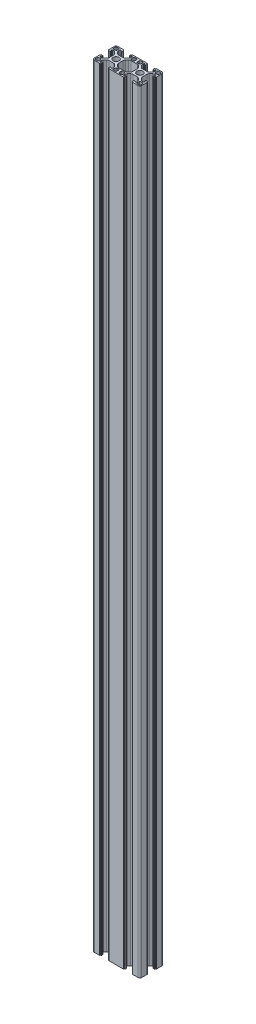
from build123d import *

# Parameters (mm, degrees)
EXTRUDE_1_DEPTH = 650


with BuildPart() as part:
    # Эскиз1 → Бобышка-Вытянуть1 (new body)
    with BuildSketch(Plane(origin=(0, 0, 0), x_dir=(1, 0, 0), z_dir=(0, 1, 0))):
        with BuildLine():
            Line((9.247825015, 4.683728486), (11.146605684, 4.683728486))
            ThreePointArc((11.146605684, 4.683728486), (11.911972549, 4.835969421), (12.560819246, 5.269514923))
            Line((12.560819246, 5.269514923), (13.862038577, 6.570734254))
            ThreePointArc((13.862038577, 6.570734254), (14.29558408, 7.219580952), (14.447825015, 7.984947817))
            Line((14.447825015, 7.984947817), (14.447825015, 8.883728486))
            ThreePointArc((14.447825015, 8.883728486), (14.301378405, 9.237281876), (13.947825015, 9.383728486))
            Line((13.947825015, 9.383728486), (13.844931796, 9.383728486))
            ThreePointArc((13.844931796, 9.383728486), (13.65359008, 9.345668252), (13.491378405, 9.237281876))
            Line((13.491378405, 9.237281876), (13.01104832, 8.75695179))
            ThreePointArc((13.01104832, 8.75695179), (12.929942482, 8.702758603), (12.834271624, 8.683728486))
            Line((12.834271624, 8.683728486), (12.547825015, 8.683728486))
            ThreePointArc((12.547825015, 8.683728486), (12.37104832, 8.75695179), (12.297825015, 8.933728486))
            Line((12.297825015, 8.933728486), (12.297825015, 10.082799306))
            ThreePointArc((12.297825015, 10.082799306), (12.341758998, 10.188865323), (12.447825015, 10.232799306))
            Line((12.447825015, 10.232799306), (12.947825015, 10.232799306))
            Line((12.947825015, 10.232799306), (12.947825015, 10.533728486))
            ThreePointArc((12.947825015, 10.533728486), (12.991758998, 10.639794503), (13.097825015, 10.683728486))
            Line((13.097825015, 10.683728486), (17.747825015, 10.683728486))
            ThreePointArc((17.747825015, 10.683728486), (18.808485187, 10.244388658), (19.247825015, 9.183728486))
            Line((19.247825015, 9.183728486), (19.247825015, 4.533728486))
            ThreePointArc((19.247825015, 4.533728486), (19.203891032, 4.427662469), (19.097825015, 4.383728486))
            Line((19.097825015, 4.383728486), (18.796895835, 4.383728486))
            Line((18.796895835, 4.383728486), (18.796895835, 3.883728486))
            ThreePointArc((18.796895835, 3.883728486), (18.752961853, 3.777662469), (18.646895835, 3.733728486))
            Line((18.646895835, 3.733728486), (17.497825015, 3.733728486))
            ThreePointArc((17.497825015, 3.733728486), (17.32104832, 3.80695179), (17.247825015, 3.983728486))
            Line((17.247825015, 3.983728486), (17.247825015, 4.270175095))
            ThreePointArc((17.247825015, 4.270175095), (17.266855132, 4.365845953), (17.32104832, 4.44695179))
            Line((17.32104832, 4.44695179), (17.801378405, 4.927281876))
            ThreePointArc((17.801378405, 4.927281876), (17.909764781, 5.089493551), (17.947825015, 5.280835267))
            Line((17.947825015, 5.280835267), (17.947825015, 5.383728486))
            ThreePointArc((17.947825015, 5.383728486), (17.801378405, 5.737281876), (17.447825015, 5.883728486))
            Line((17.447825015, 5.883728486), (16.549044346, 5.883728486))
            ThreePointArc((16.549044346, 5.883728486), (15.783677481, 5.731487551), (15.134830783, 5.297942048))
            Line((15.134830783, 5.297942048), (13.833611452, 3.996722717))
            ThreePointArc((13.833611452, 3.996722717), (13.40006595, 3.34787602), (13.247825015, 2.582509155))
            Line((13.247825015, 2.582509155), (13.247825015, 0.683728486))
            Line((13.247825015, 0.683728486), (13.247825015, -1.215052183))
            ThreePointArc((13.247825015, -1.215052183), (13.40006595, -1.980419048), (13.833611452, -2.629265746))
            Line((13.833611452, -2.629265746), (15.134830783, -3.930485077))
            ThreePointArc((15.134830783, -3.930485077), (15.783677481, -4.364030579), (16.549044346, -4.516271514))
            Line((16.549044346, -4.516271514), (17.447825015, -4.516271514))
            ThreePointArc((17.447825015, -4.516271514), (17.801378405, -4.369824905), (17.947825015, -4.016271514))
            Line((17.947825015, -4.016271514), (17.947825015, -3.913378295))
            ThreePointArc((17.947825015, -3.913378295), (17.909764781, -3.722036579), (17.801378405, -3.559824905))
            Line((17.801378405, -3.559824905), (17.32104832, -3.079494819))
            ThreePointArc((17.32104832, -3.079494819), (17.266855132, -2.998388982), (17.247825015, -2.902718124))
            Line((17.247825015, -2.902718124), (17.247825015, -2.616271514))
            ThreePointArc((17.247825015, -2.616271514), (17.32104832, -2.439494819), (17.497825015, -2.366271514))
            Line((17.497825015, -2.366271514), (18.646895835, -2.366271514))
            ThreePointArc((18.646895835, -2.366271514), (18.752961853, -2.410205497), (18.796895835, -2.516271514))
            Line((18.796895835, -2.516271514), (18.796895835, -3.016271514))
            Line((18.796895835, -3.016271514), (19.097825015, -3.016271514))
            ThreePointArc((19.097825015, -3.016271514), (19.203891032, -3.060205497), (19.247825015, -3.166271514))
            Line((19.247825015, -3.166271514), (19.247825015, -7.816271514))
            ThreePointArc((19.247825015, -7.816271514), (18.808485187, -8.876931686), (17.747825015, -9.316271514))
            Line((17.747825015, -9.316271514), (13.097825015, -9.316271514))
            ThreePointArc((13.097825015, -9.316271514), (12.991758998, -9.272337531), (12.947825015, -9.166271514))
            Line((12.947825015, -9.166271514), (12.947825015, -8.865342335))
            Line((12.947825015, -8.865342335), (12.447825015, -8.865342335))
            ThreePointArc((12.447825015, -8.865342335), (12.341758998, -8.821408352), (12.297825015, -8.715342335))
            Line((12.297825015, -8.715342335), (12.297825015, -7.566271514))
            ThreePointArc((12.297825015, -7.566271514), (12.37104832, -7.389494819), (12.547825015, -7.316271514))
            Line((12.547825015, -7.316271514), (12.834271624, -7.316271514))
            ThreePointArc((12.834271624, -7.316271514), (12.929942482, -7.335301631), (13.01104832, -7.389494819))
            Line((13.01104832, -7.389494819), (13.491378405, -7.869824905))
            ThreePointArc((13.491378405, -7.869824905), (13.65359008, -7.978211281), (13.844931796, -8.016271514))
            Line((13.844931796, -8.016271514), (13.947825015, -8.016271514))
            ThreePointArc((13.947825015, -8.016271514), (14.301378405, -7.869824905), (14.447825015, -7.516271514))
            Line((14.447825015, -7.516271514), (14.447825015, -6.617490845))
            ThreePointArc((14.447825015, -6.617490845), (14.29558408, -5.85212398), (13.862038577, -5.203277283))
            Line((13.862038577, -5.203277283), (12.560819246, -3.902057952))
            ThreePointArc((12.560819246, -3.902057952), (11.911972549, -3.468512449), (11.146605684, -3.316271514))
            Line((11.146605684, -3.316271514), (9.247825015, -3.316271514))
            Line((9.247825015, -3.316271514), (7.349044346, -3.316271514))
            ThreePointArc((7.349044346, -3.316271514), (6.583677481, -3.468512449), (5.934830783, -3.902057952))
            Line((5.934830783, -3.902057952), (4.633611452, -5.203277283))
            ThreePointArc((4.633611452, -5.203277283), (4.20006595, -5.85212398), (4.047825015, -6.617490845))
            Line((4.047825015, -6.617490845), (4.047825015, -7.516271514))
            ThreePointArc((4.047825015, -7.516271514), (4.194271624, -7.869824905), (4.547825015, -8.016271514))
            Line((4.547825015, -8.016271514), (4.650718234, -8.016271514))
            ThreePointArc((4.650718234, -8.016271514), (4.84205995, -7.978211281), (5.004271624, -7.869824905))
            Line((5.004271624, -7.869824905), (5.48460171, -7.389494819))
            ThreePointArc((5.48460171, -7.389494819), (5.565707547, -7.335301631), (5.661378405, -7.316271514))
            Line((5.661378405, -7.316271514), (5.947825015, -7.316271514))
            ThreePointArc((5.947825015, -7.316271514), (6.12460171, -7.389494819), (6.197825015, -7.566271514))
            Line((6.197825015, -7.566271514), (6.197825015, -8.715342335))
            ThreePointArc((6.197825015, -8.715342335), (6.153891032, -8.821408352), (6.047825015, -8.865342335))
            Line((6.047825015, -8.865342335), (5.547825015, -8.865342335))
            Line((5.547825015, -8.865342335), (5.547825015, -9.166271514))
            ThreePointArc((5.547825015, -9.166271514), (5.503891032, -9.272337531), (5.397825015, -9.316271514))
            Line((5.397825015, -9.316271514), (0.747825015, -9.316271514))
            Line((0.747825015, -9.316271514), (-2.252174985, -9.316271514))
            Line((-2.252174985, -9.316271514), (-6.902174985, -9.316271514))
            ThreePointArc((-6.902174985, -9.316271514), (-7.008241002, -9.272337531), (-7.052174985, -9.166271514))
            Line((-7.052174985, -9.166271514), (-7.052174985, -8.865342335))
            Line((-7.052174985, -8.865342335), (-7.552174985, -8.865342335))
            ThreePointArc((-7.552174985, -8.865342335), (-7.658241002, -8.821408352), (-7.702174985, -8.715342335))
            Line((-7.702174985, -8.715342335), (-7.702174985, -7.566271514))
            ThreePointArc((-7.702174985, -7.566271514), (-7.62895168, -7.389494819), (-7.452174985, -7.316271514))
            Line((-7.452174985, -7.316271514), (-7.165728376, -7.316271514))
            ThreePointArc((-7.165728376, -7.316271514), (-7.070057518, -7.335301631), (-6.98895168, -7.389494819))
            Line((-6.98895168, -7.389494819), (-6.508621595, -7.869824905))
            ThreePointArc((-6.508621595, -7.869824905), (-6.34640992, -7.978211281), (-6.155068204, -8.016271514))
            Line((-6.155068204, -8.016271514), (-6.052174985, -8.016271514))
            ThreePointArc((-6.052174985, -8.016271514), (-5.698621595, -7.869824905), (-5.552174985, -7.516271514))
            Line((-5.552174985, -7.516271514), (-5.552174985, -6.617490845))
            ThreePointArc((-5.552174985, -6.617490845), (-5.70441592, -5.85212398), (-6.137961423, -5.203277283))
            Line((-6.137961423, -5.203277283), (-7.439180754, -3.902057952))
            ThreePointArc((-7.439180754, -3.902057952), (-8.088027451, -3.468512449), (-8.853394316, -3.316271514))
            Line((-8.853394316, -3.316271514), (-10.752174985, -3.316271514))
            Line((-10.752174985, -3.316271514), (-12.650955654, -3.316271514))
            ThreePointArc((-12.650955654, -3.316271514), (-13.416322519, -3.468512449), (-14.065169217, -3.902057952))
            Line((-14.065169217, -3.902057952), (-15.366388548, -5.203277283))
            ThreePointArc((-15.366388548, -5.203277283), (-15.79993405, -5.85212398), (-15.952174985, -6.617490845))
            Line((-15.952174985, -6.617490845), (-15.952174985, -7.516271514))
            ThreePointArc((-15.952174985, -7.516271514), (-15.805728376, -7.869824905), (-15.452174985, -8.016271514))
            Line((-15.452174985, -8.016271514), (-15.349281766, -8.016271514))
            ThreePointArc((-15.349281766, -8.016271514), (-15.15794005, -7.978211281), (-14.995728376, -7.869824905))
            Line((-14.995728376, -7.869824905), (-14.51539829, -7.389494819))
            ThreePointArc((-14.51539829, -7.389494819), (-14.434292453, -7.335301631), (-14.338621595, -7.316271514))
            Line((-14.338621595, -7.316271514), (-14.052174985, -7.316271514))
            ThreePointArc((-14.052174985, -7.316271514), (-13.87539829, -7.389494819), (-13.802174985, -7.566271514))
            Line((-13.802174985, -7.566271514), (-13.802174985, -8.715342335))
            ThreePointArc((-13.802174985, -8.715342335), (-13.846108968, -8.821408352), (-13.952174985, -8.865342335))
            Line((-13.952174985, -8.865342335), (-14.452174985, -8.865342335))
            Line((-14.452174985, -8.865342335), (-14.452174985, -9.166271514))
            ThreePointArc((-14.452174985, -9.166271514), (-14.496108968, -9.272337531), (-14.602174985, -9.316271514))
            Line((-14.602174985, -9.316271514), (-19.252174985, -9.316271514))
            ThreePointArc((-19.252174985, -9.316271514), (-20.312835157, -8.876931686), (-20.752174985, -7.816271514))
            Line((-20.752174985, -7.816271514), (-20.752174985, -3.166271514))
            ThreePointArc((-20.752174985, -3.166271514), (-20.708241002, -3.060205497), (-20.602174985, -3.016271514))
            Line((-20.602174985, -3.016271514), (-20.301245806, -3.016271514))
            Line((-20.301245806, -3.016271514), (-20.301245806, -2.516271514))
            ThreePointArc((-20.301245806, -2.516271514), (-20.257311823, -2.410205497), (-20.151245806, -2.366271514))
            Line((-20.151245806, -2.366271514), (-19.002174985, -2.366271514))
            ThreePointArc((-19.002174985, -2.366271514), (-18.82539829, -2.439494819), (-18.752174985, -2.616271514))
            Line((-18.752174985, -2.616271514), (-18.752174985, -2.902718124))
            ThreePointArc((-18.752174985, -2.902718124), (-18.771205102, -2.998388982), (-18.82539829, -3.079494819))
            Line((-18.82539829, -3.079494819), (-19.305728376, -3.559824905))
            ThreePointArc((-19.305728376, -3.559824905), (-19.414114751, -3.722036579), (-19.452174985, -3.913378295))
            Line((-19.452174985, -3.913378295), (-19.452174985, -4.016271514))
            ThreePointArc((-19.452174985, -4.016271514), (-19.305728376, -4.369824905), (-18.952174985, -4.516271514))
            Line((-18.952174985, -4.516271514), (-18.053394316, -4.516271514))
            ThreePointArc((-18.053394316, -4.516271514), (-17.288027451, -4.364030579), (-16.639180754, -3.930485077))
            Line((-16.639180754, -3.930485077), (-15.337961423, -2.629265746))
            ThreePointArc((-15.337961423, -2.629265746), (-14.90441592, -1.980419048), (-14.752174985, -1.215052183))
            Line((-14.752174985, -1.215052183), (-14.752174985, 0.683728486))
            Line((-14.752174985, 0.683728486), (-14.752174985, 2.582509155))
            ThreePointArc((-14.752174985, 2.582509155), (-14.90441592, 3.34787602), (-15.337961423, 3.996722717))
            Line((-15.337961423, 3.996722717), (-16.639180754, 5.297942048))
            ThreePointArc((-16.639180754, 5.297942048), (-17.288027451, 5.731487551), (-18.053394316, 5.883728486))
            Line((-18.053394316, 5.883728486), (-18.952174985, 5.883728486))
            ThreePointArc((-18.952174985, 5.883728486), (-19.305728376, 5.737281876), (-19.452174985, 5.383728486))
            Line((-19.452174985, 5.383728486), (-19.452174985, 5.280835267))
            ThreePointArc((-19.452174985, 5.280835267), (-19.414114751, 5.089493551), (-19.305728376, 4.927281876))
            Line((-19.305728376, 4.927281876), (-18.82539829, 4.44695179))
            ThreePointArc((-18.82539829, 4.44695179), (-18.771205102, 4.365845953), (-18.752174985, 4.270175095))
            Line((-18.752174985, 4.270175095), (-18.752174985, 3.983728486))
            ThreePointArc((-18.752174985, 3.983728486), (-18.82539829, 3.80695179), (-19.002174985, 3.733728486))
            Line((-19.002174985, 3.733728486), (-20.151245806, 3.733728486))
            ThreePointArc((-20.151245806, 3.733728486), (-20.257311823, 3.777662469), (-20.301245806, 3.883728486))
            Line((-20.301245806, 3.883728486), (-20.301245806, 4.383728486))
            Line((-20.301245806, 4.383728486), (-20.602174985, 4.383728486))
            ThreePointArc((-20.602174985, 4.383728486), (-20.708241002, 4.427662469), (-20.752174985, 4.533728486))
            Line((-20.752174985, 4.533728486), (-20.752174985, 9.183728486))
            ThreePointArc((-20.752174985, 9.183728486), (-20.312835157, 10.244388658), (-19.252174985, 10.683728486))
            Line((-19.252174985, 10.683728486), (-14.602174985, 10.683728486))
            ThreePointArc((-14.602174985, 10.683728486), (-14.496108968, 10.639794503), (-14.452174985, 10.533728486))
            Line((-14.452174985, 10.533728486), (-14.452174985, 10.232799306))
            Line((-14.452174985, 10.232799306), (-13.952174985, 10.232799306))
            ThreePointArc((-13.952174985, 10.232799306), (-13.846108968, 10.188865323), (-13.802174985, 10.082799306))
            Line((-13.802174985, 10.082799306), (-13.802174985, 8.933728486))
            ThreePointArc((-13.802174985, 8.933728486), (-13.87539829, 8.75695179), (-14.052174985, 8.683728486))
            Line((-14.052174985, 8.683728486), (-14.338621595, 8.683728486))
            ThreePointArc((-14.338621595, 8.683728486), (-14.434292453, 8.702758603), (-14.51539829, 8.75695179))
            Line((-14.51539829, 8.75695179), (-14.995728376, 9.237281876))
            ThreePointArc((-14.995728376, 9.237281876), (-15.15794005, 9.345668252), (-15.349281766, 9.383728486))
            Line((-15.349281766, 9.383728486), (-15.452174985, 9.383728486))
            ThreePointArc((-15.452174985, 9.383728486), (-15.805728376, 9.237281876), (-15.952174985, 8.883728486))
            Line((-15.952174985, 8.883728486), (-15.952174985, 7.984947817))
            ThreePointArc((-15.952174985, 7.984947817), (-15.79993405, 7.219580952), (-15.366388548, 6.570734254))
            Line((-15.366388548, 6.570734254), (-14.065169217, 5.269514923))
            ThreePointArc((-14.065169217, 5.269514923), (-13.416322519, 4.835969421), (-12.650955654, 4.683728486))
            Line((-12.650955654, 4.683728486), (-10.752174985, 4.683728486))
            Line((-10.752174985, 4.683728486), (-8.853394316, 4.683728486))
            ThreePointArc((-8.853394316, 4.683728486), (-8.088027451, 4.835969421), (-7.439180754, 5.269514923))
            Line((-7.439180754, 5.269514923), (-6.137961423, 6.570734254))
            ThreePointArc((-6.137961423, 6.570734254), (-5.70441592, 7.219580952), (-5.552174985, 7.984947817))
            Line((-5.552174985, 7.984947817), (-5.552174985, 8.883728486))
            ThreePointArc((-5.552174985, 8.883728486), (-5.698621595, 9.237281876), (-6.052174985, 9.383728486))
            Line((-6.052174985, 9.383728486), (-6.155068204, 9.383728486))
            ThreePointArc((-6.155068204, 9.383728486), (-6.34640992, 9.345668252), (-6.508621595, 9.237281876))
            Line((-6.508621595, 9.237281876), (-6.98895168, 8.75695179))
            ThreePointArc((-6.98895168, 8.75695179), (-7.070057518, 8.702758603), (-7.165728376, 8.683728486))
            Line((-7.165728376, 8.683728486), (-7.452174985, 8.683728486))
            ThreePointArc((-7.452174985, 8.683728486), (-7.62895168, 8.75695179), (-7.702174985, 8.933728486))
            Line((-7.702174985, 8.933728486), (-7.702174985, 10.082799306))
            ThreePointArc((-7.702174985, 10.082799306), (-7.658241002, 10.188865323), (-7.552174985, 10.232799306))
            Line((-7.552174985, 10.232799306), (-7.052174985, 10.232799306))
            Line((-7.052174985, 10.232799306), (-7.052174985, 10.533728486))
            ThreePointArc((-7.052174985, 10.533728486), (-7.008241002, 10.639794503), (-6.902174985, 10.683728486))
            Line((-6.902174985, 10.683728486), (-2.252174985, 10.683728486))
            Line((-2.252174985, 10.683728486), (0.747825015, 10.683728486))
            Line((0.747825015, 10.683728486), (5.397825015, 10.683728486))
            ThreePointArc((5.397825015, 10.683728486), (5.503891032, 10.639794503), (5.547825015, 10.533728486))
            Line((5.547825015, 10.533728486), (5.547825015, 10.232799306))
            Line((5.547825015, 10.232799306), (6.047825015, 10.232799306))
            ThreePointArc((6.047825015, 10.232799306), (6.153891032, 10.188865323), (6.197825015, 10.082799306))
            Line((6.197825015, 10.082799306), (6.197825015, 8.933728486))
            ThreePointArc((6.197825015, 8.933728486), (6.12460171, 8.75695179), (5.947825015, 8.683728486))
            Line((5.947825015, 8.683728486), (5.661378405, 8.683728486))
            ThreePointArc((5.661378405, 8.683728486), (5.565707547, 8.702758603), (5.48460171, 8.75695179))
            Line((5.48460171, 8.75695179), (5.004271624, 9.237281876))
            ThreePointArc((5.004271624, 9.237281876), (4.84205995, 9.345668252), (4.650718234, 9.383728486))
            Line((4.650718234, 9.383728486), (4.547825015, 9.383728486))
            ThreePointArc((4.547825015, 9.383728486), (4.194271624, 9.237281876), (4.047825015, 8.883728486))
            Line((4.047825015, 8.883728486), (4.047825015, 7.984947817))
            ThreePointArc((4.047825015, 7.984947817), (4.20006595, 7.219580952), (4.633611452, 6.570734254))
            Line((4.633611452, 6.570734254), (5.934830783, 5.269514923))
            ThreePointArc((5.934830783, 5.269514923), (6.583677481, 4.835969421), (7.349044346, 4.683728486))
            Line((7.349044346, 4.683728486), (9.247825015, 4.683728486))
        make_face()
        with BuildLine():
            Line((16.147825015, 6.783728486), (17.547825015, 6.783728486))
            ThreePointArc((17.547825015, 6.783728486), (18.11351044, 7.018043061), (18.347825015, 7.583728486))
            Line((18.347825015, 7.583728486), (18.347825015, 8.983728486))
            ThreePointArc((18.347825015, 8.983728486), (18.11351044, 9.549413911), (17.547825015, 9.783728486))
            Line((17.547825015, 9.783728486), (16.147825015, 9.783728486))
            ThreePointArc((16.147825015, 9.783728486), (15.58213959, 9.549413911), (15.347825015, 8.983728486))
            Line((15.347825015, 8.983728486), (15.347825015, 7.583728486))
            ThreePointArc((15.347825015, 7.583728486), (15.58213959, 7.018043061), (16.147825015, 6.783728486))
        make_face(mode=Mode.SUBTRACT)
        with BuildLine():
            Line((15.347825015, -6.216271514), (15.347825015, -7.616271514))
            ThreePointArc((15.347825015, -7.616271514), (15.58213959, -8.181956939), (16.147825015, -8.416271514))
            Line((16.147825015, -8.416271514), (17.547825015, -8.416271514))
            ThreePointArc((17.547825015, -8.416271514), (18.11351044, -8.181956939), (18.347825015, -7.616271514))
            Line((18.347825015, -7.616271514), (18.347825015, -6.216271514))
            ThreePointArc((18.347825015, -6.216271514), (18.11351044, -5.650586089), (17.547825015, -5.416271514))
            Line((17.547825015, -5.416271514), (16.147825015, -5.416271514))
            ThreePointArc((16.147825015, -5.416271514), (15.58213959, -5.650586089), (15.347825015, -6.216271514))
        make_face(mode=Mode.SUBTRACT)
        with BuildLine():
            Line((2.347825015, -5.416271514), (0.947825015, -5.416271514))
            ThreePointArc((0.947825015, -5.416271514), (0.38213959, -5.650586089), (0.147825015, -6.216271514))
            Line((0.147825015, -6.216271514), (0.147825015, -7.616271514))
            ThreePointArc((0.147825015, -7.616271514), (0.38213959, -8.181956939), (0.947825015, -8.416271514))
            Line((0.947825015, -8.416271514), (2.347825015, -8.416271514))
            ThreePointArc((2.347825015, -8.416271514), (2.91351044, -8.181956939), (3.147825015, -7.616271514))
            Line((3.147825015, -7.616271514), (3.147825015, -6.216271514))
            ThreePointArc((3.147825015, -6.216271514), (2.91351044, -5.650586089), (2.347825015, -5.416271514))
        make_face(mode=Mode.SUBTRACT)
        with BuildLine():
            Line((1.047825015, -4.516271514), (1.946605684, -4.516271514))
            ThreePointArc((1.946605684, -4.516271514), (2.711972549, -4.364030579), (3.360819246, -3.930485077))
            Line((3.360819246, -3.930485077), (4.662038577, -2.629265746))
            ThreePointArc((4.662038577, -2.629265746), (5.09558408, -1.980419048), (5.247825015, -1.215052183))
            Line((5.247825015, -1.215052183), (5.247825015, 0.683728486))
            Line((5.247825015, 0.683728486), (5.247825015, 2.582509155))
            ThreePointArc((5.247825015, 2.582509155), (5.09558408, 3.34787602), (4.662038577, 3.996722717))
            Line((4.662038577, 3.996722717), (3.360819246, 5.297942048))
            ThreePointArc((3.360819246, 5.297942048), (2.711972549, 5.731487551), (1.946605684, 5.883728486))
            Line((1.946605684, 5.883728486), (1.047825015, 5.883728486))
            Line((1.047825015, 5.883728486), (-2.552174985, 5.883728486))
            Line((-2.552174985, 5.883728486), (-3.450955654, 5.883728486))
            ThreePointArc((-3.450955654, 5.883728486), (-4.216322519, 5.731487551), (-4.865169217, 5.297942048))
            Line((-4.865169217, 5.297942048), (-6.166388548, 3.996722717))
            ThreePointArc((-6.166388548, 3.996722717), (-6.59993405, 3.34787602), (-6.752174985, 2.582509155))
            Line((-6.752174985, 2.582509155), (-6.752174985, 0.683728486))
            Line((-6.752174985, 0.683728486), (-6.752174985, -1.215052183))
            ThreePointArc((-6.752174985, -1.215052183), (-6.59993405, -1.980419048), (-6.166388548, -2.629265746))
            Line((-6.166388548, -2.629265746), (-4.865169217, -3.930485077))
            ThreePointArc((-4.865169217, -3.930485077), (-4.216322519, -4.364030579), (-3.450955654, -4.516271514))
            Line((-3.450955654, -4.516271514), (-2.552174985, -4.516271514))
            Line((-2.552174985, -4.516271514), (1.047825015, -4.516271514))
        make_face(mode=Mode.SUBTRACT)
        with BuildLine():
            Line((3.147825015, 7.583728486), (3.147825015, 8.983728486))
            ThreePointArc((3.147825015, 8.983728486), (2.91351044, 9.549413911), (2.347825015, 9.783728486))
            Line((2.347825015, 9.783728486), (0.947825015, 9.783728486))
            ThreePointArc((0.947825015, 9.783728486), (0.38213959, 9.549413911), (0.147825015, 8.983728486))
            Line((0.147825015, 8.983728486), (0.147825015, 7.583728486))
            ThreePointArc((0.147825015, 7.583728486), (0.38213959, 7.018043061), (0.947825015, 6.783728486))
            Line((0.947825015, 6.783728486), (2.347825015, 6.783728486))
            ThreePointArc((2.347825015, 6.783728486), (2.91351044, 7.018043061), (3.147825015, 7.583728486))
        make_face(mode=Mode.SUBTRACT)
        with BuildLine():
            Line((-2.452174985, 9.783728486), (-3.852174985, 9.783728486))
            ThreePointArc((-3.852174985, 9.783728486), (-4.41786041, 9.549413911), (-4.652174985, 8.983728486))
            Line((-4.652174985, 8.983728486), (-4.652174985, 7.583728486))
            ThreePointArc((-4.652174985, 7.583728486), (-4.41786041, 7.018043061), (-3.852174985, 6.783728486))
            Line((-3.852174985, 6.783728486), (-2.452174985, 6.783728486))
            ThreePointArc((-2.452174985, 6.783728486), (-1.88648956, 7.018043061), (-1.652174985, 7.583728486))
            Line((-1.652174985, 7.583728486), (-1.652174985, 8.983728486))
            ThreePointArc((-1.652174985, 8.983728486), (-1.88648956, 9.549413911), (-2.452174985, 9.783728486))
        make_face(mode=Mode.SUBTRACT)
        with BuildLine():
            Line((-1.652174985, -7.616271514), (-1.652174985, -6.216271514))
            ThreePointArc((-1.652174985, -6.216271514), (-1.88648956, -5.650586089), (-2.452174985, -5.416271514))
            Line((-2.452174985, -5.416271514), (-3.852174985, -5.416271514))
            ThreePointArc((-3.852174985, -5.416271514), (-4.41786041, -5.650586089), (-4.652174985, -6.216271514))
            Line((-4.652174985, -6.216271514), (-4.652174985, -7.616271514))
            ThreePointArc((-4.652174985, -7.616271514), (-4.41786041, -8.181956939), (-3.852174985, -8.416271514))
            Line((-3.852174985, -8.416271514), (-2.452174985, -8.416271514))
            ThreePointArc((-2.452174985, -8.416271514), (-1.88648956, -8.181956939), (-1.652174985, -7.616271514))
        make_face(mode=Mode.SUBTRACT)
        with BuildLine():
            Line((-19.052174985, -8.416271514), (-17.652174985, -8.416271514))
            ThreePointArc((-17.652174985, -8.416271514), (-17.08648956, -8.181956939), (-16.852174985, -7.616271514))
            Line((-16.852174985, -7.616271514), (-16.852174985, -6.216271514))
            ThreePointArc((-16.852174985, -6.216271514), (-17.08648956, -5.650586089), (-17.652174985, -5.416271514))
            Line((-17.652174985, -5.416271514), (-19.052174985, -5.416271514))
            ThreePointArc((-19.052174985, -5.416271514), (-19.61786041, -5.650586089), (-19.852174985, -6.216271514))
            Line((-19.852174985, -6.216271514), (-19.852174985, -7.616271514))
            ThreePointArc((-19.852174985, -7.616271514), (-19.61786041, -8.181956939), (-19.052174985, -8.416271514))
        make_face(mode=Mode.SUBTRACT)
        with BuildLine():
            Line((-19.852174985, 8.983728486), (-19.852174985, 7.583728486))
            ThreePointArc((-19.852174985, 7.583728486), (-19.61786041, 7.018043061), (-19.052174985, 6.783728486))
            Line((-19.052174985, 6.783728486), (-17.652174985, 6.783728486))
            ThreePointArc((-17.652174985, 6.783728486), (-17.08648956, 7.018043061), (-16.852174985, 7.583728486))
            Line((-16.852174985, 7.583728486), (-16.852174985, 8.983728486))
            ThreePointArc((-16.852174985, 8.983728486), (-17.08648956, 9.549413911), (-17.652174985, 9.783728486))
            Line((-17.652174985, 9.783728486), (-19.052174985, 9.783728486))
            ThreePointArc((-19.052174985, 9.783728486), (-19.61786041, 9.549413911), (-19.852174985, 8.983728486))
        make_face(mode=Mode.SUBTRACT)
        with BuildLine():
            ThreePointArc((11.747825015, 0.683728486), (11.015591968, 2.451495439), (9.247825015, 3.183728486))
            ThreePointArc((9.247825015, 3.183728486), (7.480058062, 2.451495439), (6.747825015, 0.683728486))
            ThreePointArc((6.747825015, 0.683728486), (7.480058062, -1.084038467), (9.247825015, -1.816271514))
            ThreePointArc((9.247825015, -1.816271514), (11.015591968, -1.084038467), (11.747825015, 0.683728486))
        make_face(mode=Mode.SUBTRACT)
        with BuildLine():
            ThreePointArc((-10.752174985, 3.183728486), (-8.984408032, 2.451495439), (-8.252174985, 0.683728486))
            ThreePointArc((-8.252174985, 0.683728486), (-8.984408032, -1.084038467), (-10.752174985, -1.816271514))
            ThreePointArc((-10.752174985, -1.816271514), (-12.519941938, -1.084038467), (-13.252174985, 0.683728486))
            ThreePointArc((-13.252174985, 0.683728486), (-12.519941938, 2.451495439), (-10.752174985, 3.183728486))
        make_face(mode=Mode.SUBTRACT)
    extrude(amount=EXTRUDE_1_DEPTH)


solid = part.part
